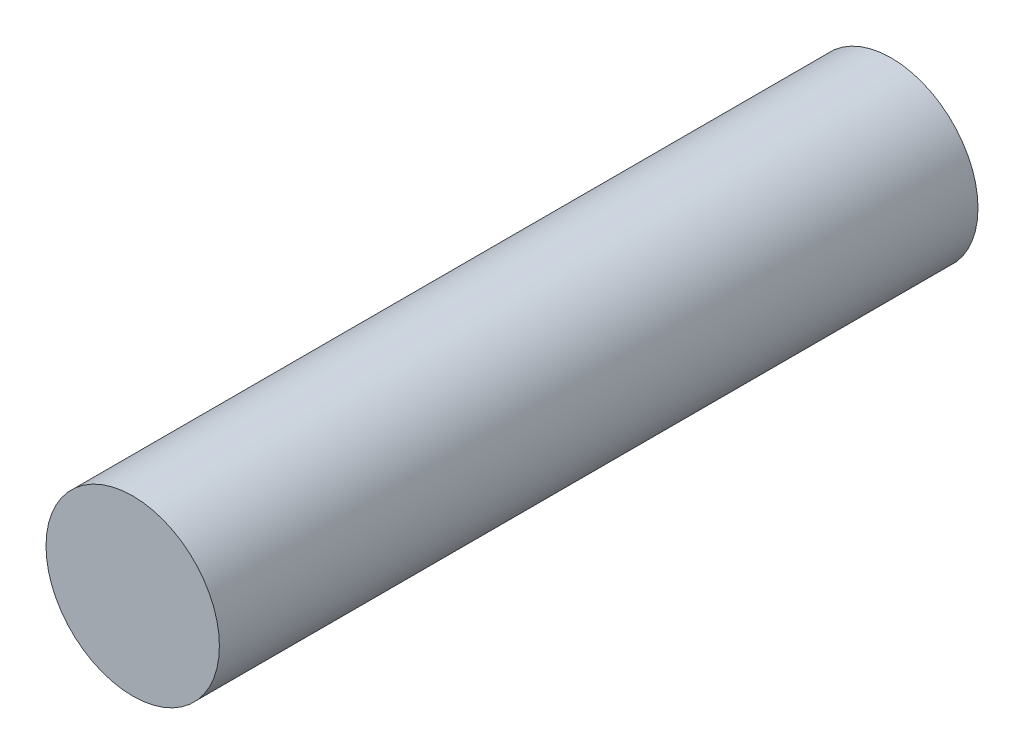
from build123d import *

# Parameters (mm, degrees)
SKIZZE1_R                       = 4
AUFSATZ_LINEAR_AUSTRAGEN1_DEPTH = 35


with BuildPart() as part:
    # Skizze1 → Aufsatz-Linear austragen1 (new body)
    with BuildSketch(Plane.XY):
        Circle(SKIZZE1_R)
    extrude(amount=AUFSATZ_LINEAR_AUSTRAGEN1_DEPTH)


solid = part.part
